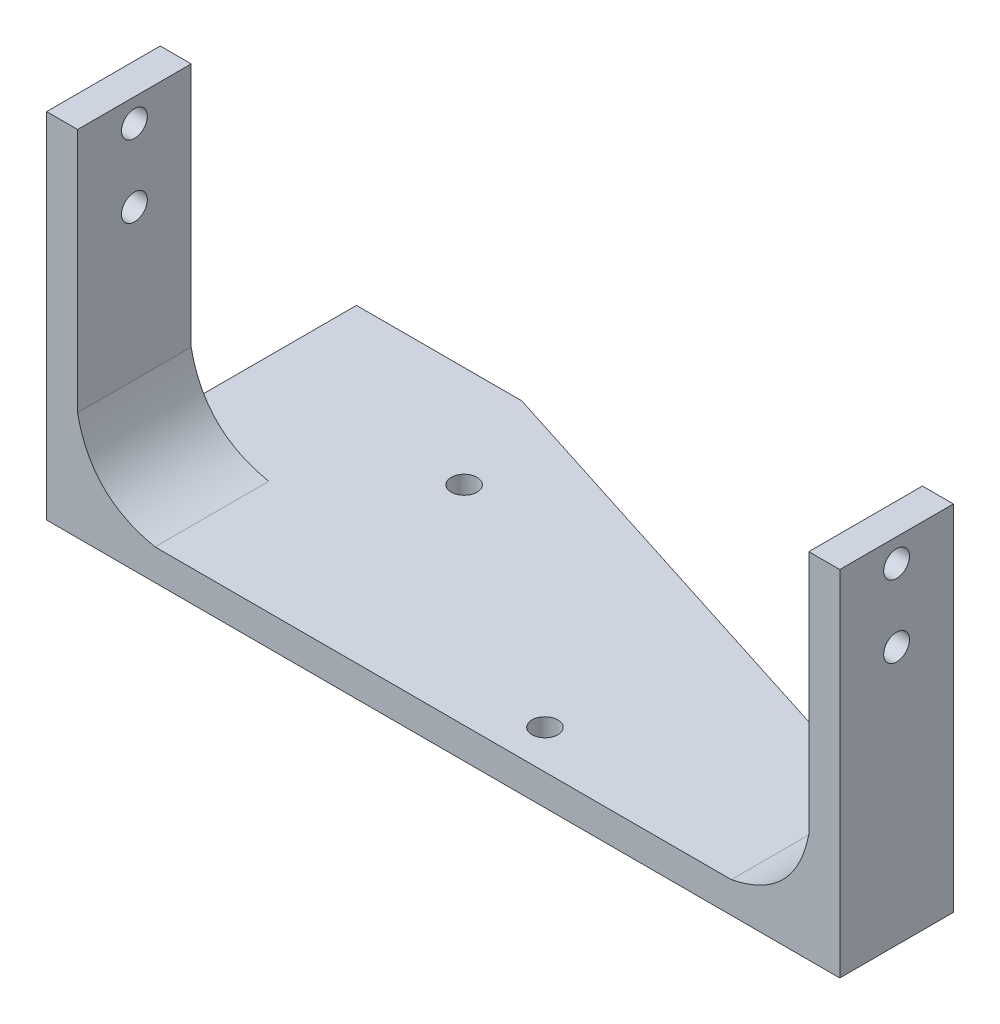
from build123d import *

# Parameters (mm, degrees)
SKETCH1_R                       = 2.5
BOSS_EXTRUDE1_DEPTH             = 6
SKETCH2_W                       = 6
SKETCH2_H                       = 22
BOSS_EXTRUDE2_DEPTH             = 62.5
BOSS_EXTRUDE3_REACH             = 176.194
SKETCH4_W                       = 6
SKETCH4_H                       = 22
BOSS_EXTRUDE3_DIRECTION_2_REACH = 176.194
SKETCH3_R                       = 2.5
CUT_EXTRUDE2_DEPTH              = 179.555261525
BOSS_EXTRUDE4_DEPTH             = 22


with BuildPart() as part:
    # Sketch1 → Boss-Extrude1 (new body)
    with BuildSketch(Plane(origin=(0, 0, 0), x_dir=(1, 0, 0), z_dir=(0, 1, 0))):
        Polygon((32, 60), (151.12, 22), (151.12, 0), (0, 0), (0, 60), align=None)
        with Locations(Location((40.5, 40.35, 0), (0, 0, 270))):
            Circle(SKETCH1_R, mode=Mode.SUBTRACT)
        with Locations(Location((89, 7.5, 0), (0, 0, 270))):
            Circle(SKETCH1_R, mode=Mode.SUBTRACT)
    extrude(amount=BOSS_EXTRUDE1_DEPTH)

    # Sketch2 → Boss-Extrude2 (add)
    with BuildSketch(Plane(origin=(0, 6, 0), x_dir=(1, 0, 0), z_dir=(0, 1, 0))):
        with Locations((3, 11)):
            Rectangle(SKETCH2_W, SKETCH2_H)
    extrude(amount=BOSS_EXTRUDE2_DEPTH)

    # Boss-Extrude3: up to this face of the body (flat: up to its plane)
    boss_extrude3_end = Plane(part.part.faces().sort_by_distance((3, 68.5, -11))[0])
    # Sketch4 → Boss-Extrude3 (add, up to the picked face)
    with BuildSketch(Plane(origin=(0, 6, 0), x_dir=(1, 0, 0), z_dir=(0, 1, 0)), mode=Mode.PRIVATE) as boss_extrude3_sk1:
        with Locations((150.589489934, 11)):
            Rectangle(SKETCH4_W, SKETCH4_H)
    boss_extrude3_tool1 = split(extrude(boss_extrude3_sk1.sketch, amount=BOSS_EXTRUDE3_REACH, mode=Mode.PRIVATE), bisect_by=boss_extrude3_end, keep=Keep.BOTH, mode=Mode.PRIVATE)
    add(boss_extrude3_tool1.solids().sort_by(Axis((150.58949, 6, -11), (0, 1, 0)))[0])

    # Boss-Extrude3 direction 2: up to this face of the body (flat: up to its plane)
    boss_extrude3_direction_2_end = Plane(part.part.faces().sort_by_distance((63.627139695, 0, -24.235973562))[0])
    # Sketch4 → Boss-Extrude3 direction 2 (add, up to the picked face)
    with BuildSketch(Plane(origin=(0, 6, 0), x_dir=(1, 0, 0), z_dir=(0, 1, 0)), mode=Mode.PRIVATE) as boss_extrude3_direction_2_sk1:
        with Locations((150.589489934, 11)):
            Rectangle(SKETCH4_W, SKETCH4_H)
    boss_extrude3_direction_2_tool1 = split(extrude(boss_extrude3_direction_2_sk1.sketch, amount=-BOSS_EXTRUDE3_DIRECTION_2_REACH, mode=Mode.PRIVATE), bisect_by=boss_extrude3_direction_2_end, keep=Keep.BOTH, mode=Mode.PRIVATE)
    add(boss_extrude3_direction_2_tool1.solids().sort_by(Axis((150.58949, 6, -11), (0, -1, 0)))[0])

    # Sketch3 → Cut-Extrude2 (cut, through all)
    with BuildSketch(Plane.ZY):
        with Locations((-11, 64)):
            Circle(SKETCH3_R)
        with Locations((-11, 50)):
            Circle(SKETCH3_R)
    extrude(amount=-CUT_EXTRUDE2_DEPTH, mode=Mode.SUBTRACT)

    # Sketch5 → Boss-Extrude4 (add)
    with BuildSketch(Plane.XY):
        with BuildLine():
            Line((6, 21), (6, 6))
            Line((6, 6), (21, 6))
            add(Edge.make_bspline(
                [(6, 21), (8.5, 8.5), (21, 6)],
                knots=[0, 0, 0, 1, 1, 1], degree=2))
        make_face()
        with BuildLine():
            Line((132.589489934, 6), (147.589489934, 6))
            Line((147.589489934, 6), (147.589489934, 21))
            add(Edge.make_bspline(
                [(147.589489934, 21), (145.089489934, 8.5), (132.589489934, 6)],
                knots=[0, 0, 0, 1, 1, 1], degree=2))
        make_face()
    extrude(amount=-BOSS_EXTRUDE4_DEPTH)


solid = part.part
